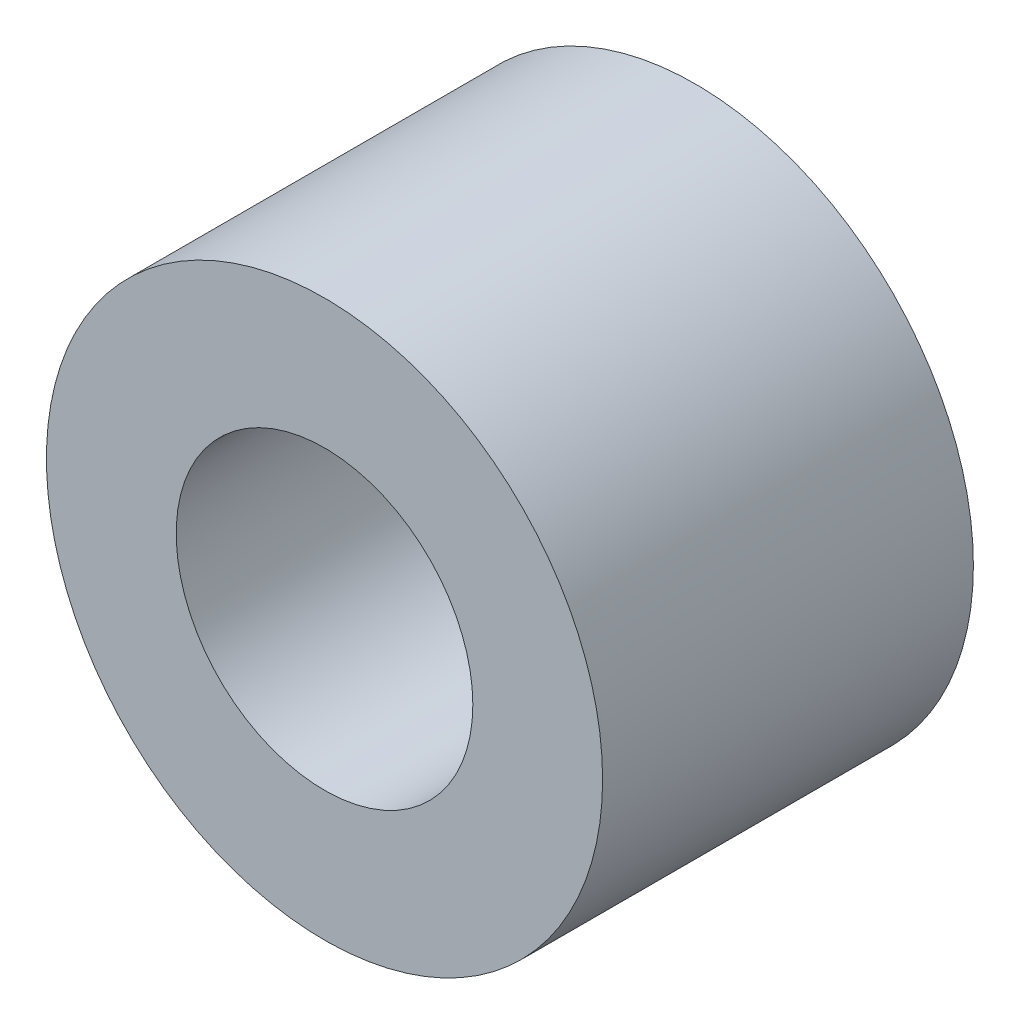
from build123d import *

# Parameters (mm, degrees)
SKETCH_1_R      = 3
SKETCH_1_R_2    = 1.6
EXTRUDE_1_DEPTH = 4


with BuildPart() as part:
    # 草图1 → 凸台-拉伸1 (new body)
    with BuildSketch(Plane.XY):
        Circle(SKETCH_1_R)
        Circle(SKETCH_1_R_2, mode=Mode.SUBTRACT)
    extrude(amount=EXTRUDE_1_DEPTH)


solid = part.part
